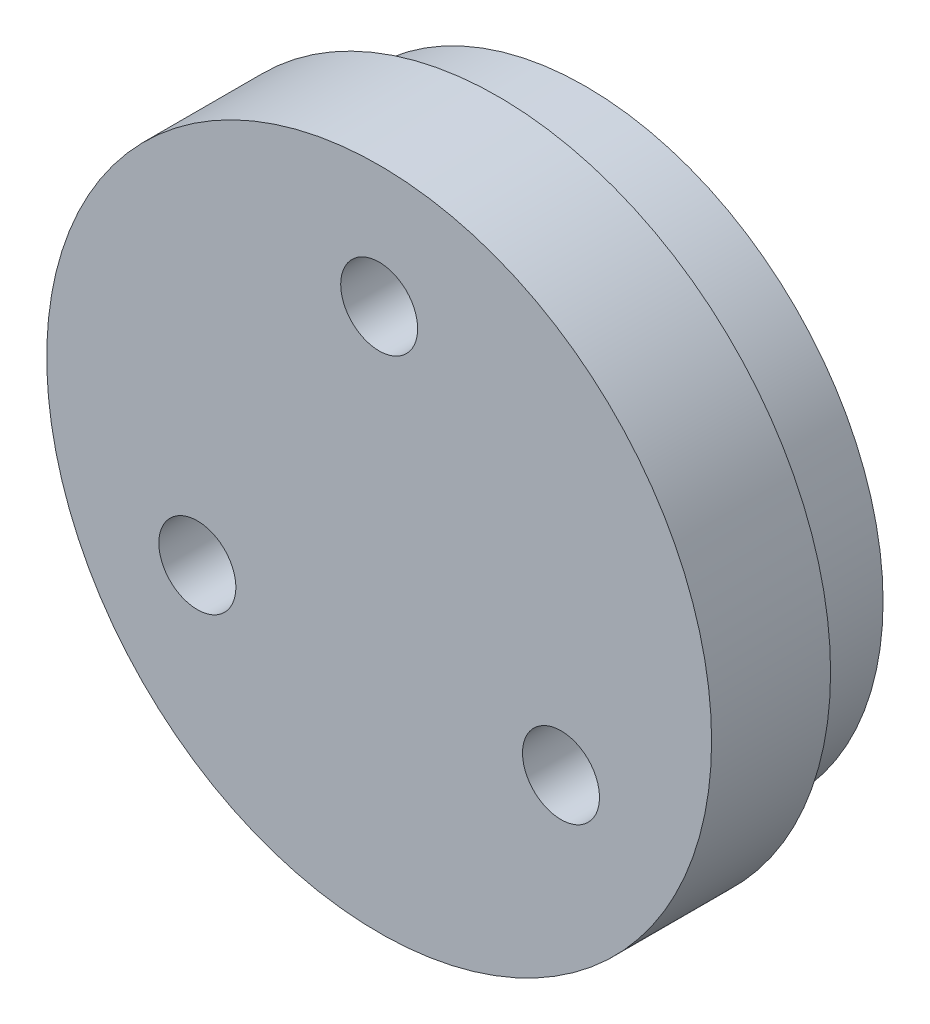
from build123d import *

# Parameters (mm, degrees)
SKETCH_1_R          = 8.5
EXTRUDE_1_DEPTH     = 2.5
SKETCH_2_R          = 9.5
EXTRUDE_2_DEPTH     = 3.4
SKETCH_3_R          = 1.1
CUT_EXTRUDE_1_DEPTH = 15.673445403


with BuildPart() as part:
    # ｽｹｯﾁ1 → ﾎﾞｽ - 押し出し1 (new body)
    with BuildSketch(Plane.XY):
        Circle(SKETCH_1_R)
    extrude(amount=EXTRUDE_1_DEPTH)

    # ｽｹｯﾁ2 → ﾎﾞｽ - 押し出し2 (add)
    with BuildSketch(Plane.XY.offset(2.5)):
        Circle(SKETCH_2_R)
    extrude(amount=EXTRUDE_2_DEPTH)

    # ｽｹｯﾁ3 → ｶｯﾄ - 押し出し1 (cut, through all)
    with BuildSketch(Plane(origin=(0, 0, 0), x_dir=(-1, 0, 0), z_dir=(0, 0, -1))):
        with Locations((0, 6)):
            Circle(SKETCH_3_R)
        with Locations((5.196152423, -3)):
            Circle(SKETCH_3_R)
        with Locations((-5.196152423, -3)):
            Circle(SKETCH_3_R)
    extrude(amount=-CUT_EXTRUDE_1_DEPTH, mode=Mode.SUBTRACT)


solid = part.part
